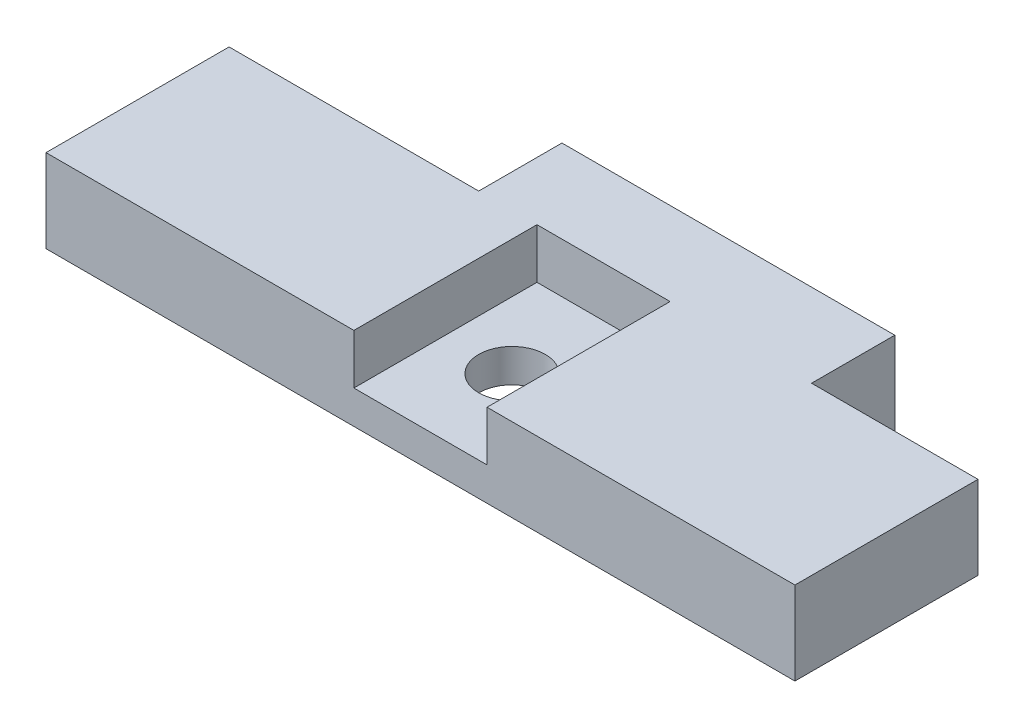
from build123d import *

# Parameters (mm, degrees)
BOSS_EXTRU_3_DEPTH      = 5
ESQUISSE4_W             = 4
ESQUISSE4_H             = 11
ENL_V_MAT_EXTRU_3_DEPTH = 3
ESQUISSE5_R             = 2
ENL_V_MAT_EXTRU_7_DEPTH = 25.397745798


with BuildPart() as part:
    # Esquisse1 → Boss.-Extru.3 (new body)
    with BuildSketch(Plane(origin=(0, 0, 0), x_dir=(1, 0, 0), z_dir=(0, 1, 0))):
        Polygon((-7.5, 8), (-7.5, 3), (-22.5, 3), (-22.5, -8), (22.5, -8), (22.5, 3), (12.5, 3), (12.5, 8), align=None)
    extrude(amount=BOSS_EXTRU_3_DEPTH)

    # Esquisse4 → Enlèv. mat.-Extru.3 (cut)
    with BuildSketch(Plane(origin=(0, 5, 0), x_dir=(1, 0, 0), z_dir=(0, 1, 0))):
        with Locations((-2, -2.5)):
            Rectangle(ESQUISSE4_W, ESQUISSE4_H)
        with Locations((2, -2.5)):
            Rectangle(ESQUISSE4_W, ESQUISSE4_H)
    extrude(amount=-ENL_V_MAT_EXTRU_3_DEPTH, mode=Mode.SUBTRACT)

    # Esquisse5 → Enlèv. mat.-Extru.7 (cut, through all)
    with BuildSketch(Plane(origin=(0, 5, 0), x_dir=(1, 0, 0), z_dir=(0, 1, 0))):
        with Locations(Location((0, -2.5, 0), (0, 0, 270))):
            Circle(ESQUISSE5_R)
    extrude(amount=-ENL_V_MAT_EXTRU_7_DEPTH, mode=Mode.SUBTRACT)


solid = part.part
